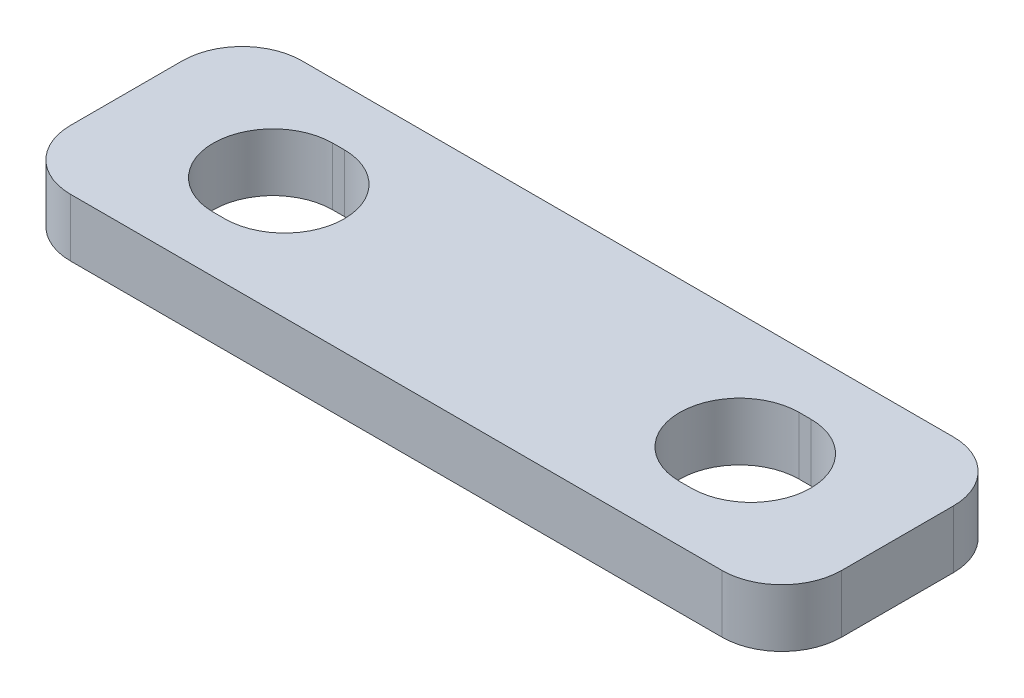
from build123d import *

# Parameters (mm, degrees)
SKETCH_1_W      = 20
SKETCH_1_H      = 6
EXTRUDE_1_DEPTH = 1.5
FILLET_1_R      = 1.55


with BuildPart() as part:
    # 草图1 → 凸台-拉伸1 (new body)
    with BuildSketch(Plane(origin=(0, 0, 0), x_dir=(1, 0, 0), z_dir=(0, 1, 0))):
        with Locations((10, 3)):
            Rectangle(SKETCH_1_W, SKETCH_1_H)
        with BuildLine():
            Line((16.2, 1.45), (15.9, 1.45))
            ThreePointArc((15.9, 1.45), (14.35, 3), (15.9, 4.55))
            Line((15.9, 4.55), (16.2, 4.55))
            ThreePointArc((16.2, 4.55), (17.75, 3), (16.2, 1.45))
        make_face(mode=Mode.SUBTRACT)
        with BuildLine():
            Line((3.8, 1.45), (4.1, 1.45))
            ThreePointArc((4.1, 1.45), (5.65, 3), (4.1, 4.55))
            Line((4.1, 4.55), (3.8, 4.55))
            ThreePointArc((3.8, 4.55), (2.25, 3), (3.8, 1.45))
        make_face(mode=Mode.SUBTRACT)
    extrude(amount=EXTRUDE_1_DEPTH)

    # 圆角1
    fillet_1_edges = [part.edges().sort_by_distance(p)[0] for p in [
        (0, 0.75, -6),
        (20, 0.75, -6),
        (20, 0.75, 0),
        (0, 0.75, 0),
    ]]
    fillet(fillet_1_edges, radius=FILLET_1_R)


solid = part.part
